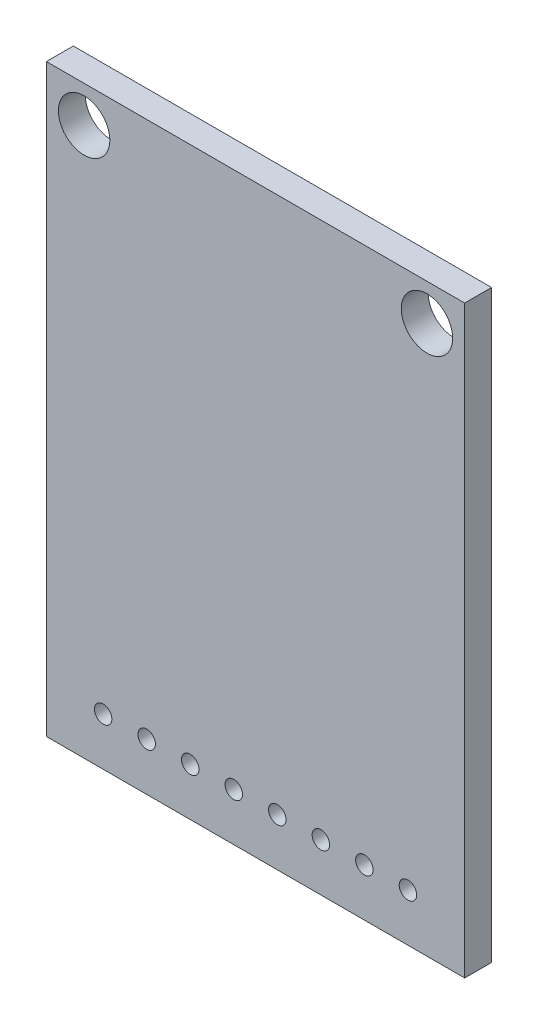
from build123d import *

# Parameters (mm, degrees)
SKETCH1_W           = 24.4
SKETCH1_H           = 34.1
SKETCH1_R           = 1.5
SKETCH1_R_2         = 0.51
BOSS_EXTRUDE1_DEPTH = 1.57


with BuildPart() as part:
    # Sketch1 → Boss-Extrude1 (new body)
    with BuildSketch(Plane.XY):
        Rectangle(SKETCH1_W, SKETCH1_H)
        with Locations((-10, 14.92)):
            Circle(SKETCH1_R, mode=Mode.SUBTRACT)
        with Locations((10, 14.92)):
            Circle(SKETCH1_R, mode=Mode.SUBTRACT)
        with Locations((-8.89, -14.26)):
            Circle(SKETCH1_R_2, mode=Mode.SUBTRACT)
        with Locations((-6.35, -14.26)):
            Circle(SKETCH1_R_2, mode=Mode.SUBTRACT)
        with Locations((-3.81, -14.26)):
            Circle(SKETCH1_R_2, mode=Mode.SUBTRACT)
        with Locations((-1.27, -14.26)):
            Circle(SKETCH1_R_2, mode=Mode.SUBTRACT)
        with Locations((1.27, -14.26)):
            Circle(SKETCH1_R_2, mode=Mode.SUBTRACT)
        with Locations((3.81, -14.26)):
            Circle(SKETCH1_R_2, mode=Mode.SUBTRACT)
        with Locations((6.35, -14.26)):
            Circle(SKETCH1_R_2, mode=Mode.SUBTRACT)
        with Locations((8.89, -14.26)):
            Circle(SKETCH1_R_2, mode=Mode.SUBTRACT)
    extrude(amount=BOSS_EXTRUDE1_DEPTH)


solid = part.part
